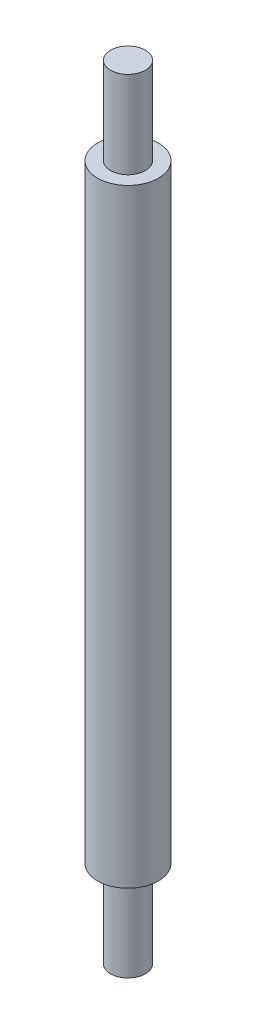
from build123d import *

# Parameters (mm, degrees)
SKETCH1_R           = 3.5
BOSS_EXTRUDE1_DEPTH = 70
SKETCH2_R           = 2
BOSS_EXTRUDE2_DEPTH = 10
BOSS_EXTRUDE3_START = 10
SKETCH3_R           = 2
BOSS_EXTRUDE3_DEPTH = 10


with BuildPart() as part:
    # Sketch1 → Boss-Extrude1 (new body)
    with BuildSketch(Plane(origin=(0, 0, 0), x_dir=(1, 0, 0), z_dir=(0, 1, 0))):
        with Locations(Location((0, 0, 0), (0, 0, 270))):
            Circle(SKETCH1_R)
    extrude(amount=BOSS_EXTRUDE1_DEPTH)

    # Sketch2 → Boss-Extrude2 (add)
    with BuildSketch(Plane(origin=(0, 70, 0), x_dir=(1, 0, 0), z_dir=(0, 1, 0))):
        with Locations(Location((0, 0, 0), (0, 0, 270))):
            Circle(SKETCH2_R)
    extrude(amount=BOSS_EXTRUDE2_DEPTH)

    # Sketch3 → Boss-Extrude3 (add)
    with BuildSketch(Plane.XZ.offset(BOSS_EXTRUDE3_START)):
        with Locations(Location((0, 0, 0), (0, 0, 90))):
            Circle(SKETCH3_R)
    extrude(amount=-BOSS_EXTRUDE3_DEPTH)


solid = part.part
